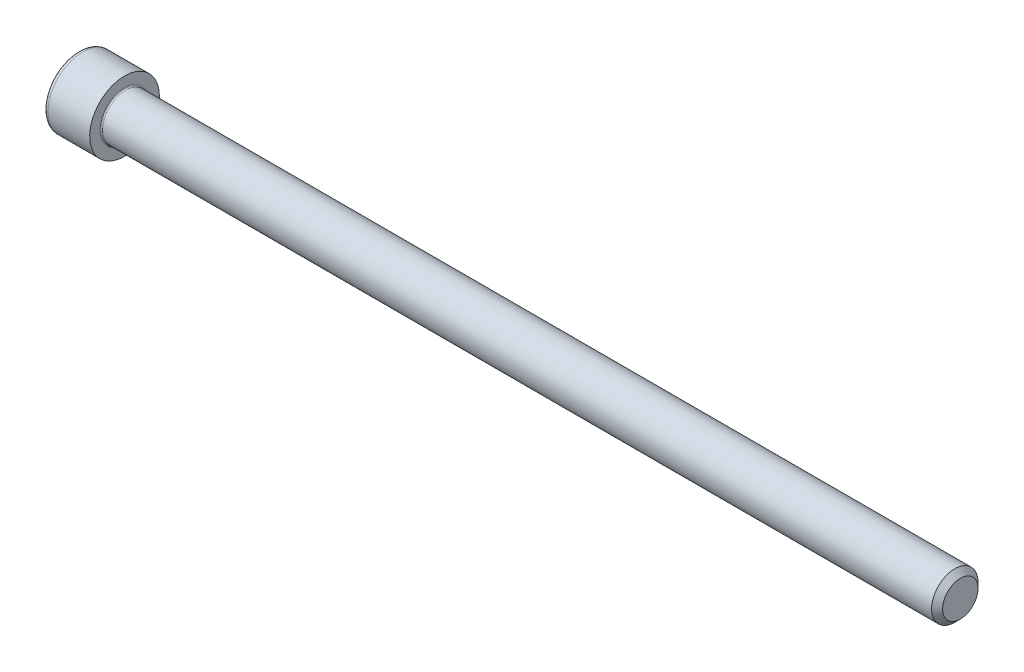
from build123d import *

# Parameters (mm, degrees)
SLOT_REACH    = 122.838
THREAD_R      = 0.635
CHAMFER1_SIZE = 0.75565
FILLET2_R     = 0.1778


with BuildPart() as part:
    # Sketch1 → Body (revolve)
    with BuildSketch(Plane.XY, mode=Mode.PRIVATE) as body_sk:
        Polygon((-1.710266667, 0), (114.3, 0), (114.3, 3.175), (88.9, 3.175), (85.7249, 3.175), (0, 3.175), (0, 4.7625), (-6.35, 4.7625), (-6.35, 2.756963005), (-3.302, 2.756963005), align=None)
    revolve(body_sk.sketch.rotate(Axis((-1.710266667, 0, 0), (1, 0, 0)), 180), axis=Axis((-1.710266667, 0, 0), (1, 0, 0)))

    # Slot: up to this cone (the profile starts inside it)
    slot_end = Plane(origin=(-6.35, 0, 0), z_dir=(-1, 0, 0)).offset(-4.639732333) * Cone(1.732e-06, 235.583136371, 136.0139862, align=(Align.CENTER, Align.CENTER, Align.MIN), mode=Mode.PRIVATE)
    # Sketch2 → Slot (add, up to the surface)
    with BuildSketch(Plane.ZY.offset(6.35), mode=Mode.PRIVATE) as slot_sk1:
        with BuildLine():
            ThreePointArc((1.378481503, -2.3876), (2.3876, -1.378481503), (2.756963005, 0))
            Line((2.756963005, 0), (1.378481503, -2.3876))
        make_face()
    slot_tool1 = extrude(slot_sk1.sketch, amount=-SLOT_REACH, mode=Mode.PRIVATE) & slot_end
    add(slot_tool1.solids().sort_by_distance((-6.35, -1.268114, 2.196438))[0])
    # Sketch2 → Slot (add, up to the surface)
    with BuildSketch(Plane.ZY.offset(6.35), mode=Mode.PRIVATE) as slot_sk2:
        with BuildLine():
            ThreePointArc((-1.378481503, -2.3876), (0, -2.756963005), (1.378481503, -2.3876))
            Line((1.378481503, -2.3876), (-1.378481503, -2.3876))
        make_face()
    slot_tool2 = extrude(slot_sk2.sketch, amount=-SLOT_REACH, mode=Mode.PRIVATE) & slot_end
    add(slot_tool2.solids().sort_by_distance((-6.35, -2.536228, 0))[0])
    # Sketch2 → Slot (add, up to the surface)
    with BuildSketch(Plane.ZY.offset(6.35), mode=Mode.PRIVATE) as slot_sk3:
        with BuildLine():
            ThreePointArc((-2.756963005, 0), (-2.3876, -1.378481503), (-1.378481503, -2.3876))
            Line((-1.378481503, -2.3876), (-2.756963005, 0))
        make_face()
    slot_tool3 = extrude(slot_sk3.sketch, amount=-SLOT_REACH, mode=Mode.PRIVATE) & slot_end
    add(slot_tool3.solids().sort_by_distance((-6.35, -1.268114, -2.196438))[0])
    # Sketch2 → Slot (add, up to the surface)
    with BuildSketch(Plane.ZY.offset(6.35), mode=Mode.PRIVATE) as slot_sk4:
        with BuildLine():
            Line((-2.756963005, 0), (-1.378481503, 2.3876))
            ThreePointArc((-1.378481503, 2.3876), (-2.3876, 1.378481503), (-2.756963005, 0))
        make_face()
    slot_tool4 = extrude(slot_sk4.sketch, amount=-SLOT_REACH, mode=Mode.PRIVATE) & slot_end
    add(slot_tool4.solids().sort_by_distance((-6.35, 1.268114, -2.196438))[0])
    # Sketch2 → Slot (add, up to the surface)
    with BuildSketch(Plane.ZY.offset(6.35), mode=Mode.PRIVATE) as slot_sk5:
        with BuildLine():
            Line((-1.378481503, 2.3876), (1.378481503, 2.3876))
            ThreePointArc((1.378481503, 2.3876), (0, 2.756963005), (-1.378481503, 2.3876))
        make_face()
    slot_tool5 = extrude(slot_sk5.sketch, amount=-SLOT_REACH, mode=Mode.PRIVATE) & slot_end
    add(slot_tool5.solids().sort_by_distance((-6.35, 2.536228, 0))[0])
    # Sketch2 → Slot (add, up to the surface)
    with BuildSketch(Plane.ZY.offset(6.35), mode=Mode.PRIVATE) as slot_sk6:
        with BuildLine():
            Line((1.378481503, 2.3876), (2.756963005, 0))
            ThreePointArc((2.756963005, 0), (2.3876, 1.378481503), (1.378481503, 2.3876))
        make_face()
    slot_tool6 = extrude(slot_sk6.sketch, amount=-SLOT_REACH, mode=Mode.PRIVATE) & slot_end
    add(slot_tool6.solids().sort_by_distance((-6.35, 1.268114, 2.196438))[0])

    # Thread
    thread_edges = [part.edges().sort_by_distance(p)[0] for p in [
        (-6.35, 4.7625, 0),
    ]]
    fillet(thread_edges, radius=THREAD_R)

    # Chamfer1
    chamfer1_edges = [part.edges().sort_by_distance(p)[0] for p in [
        (114.3, 3.175, 0),
    ]]
    chamfer(chamfer1_edges, length=CHAMFER1_SIZE)

    # Fillet2
    fillet2_edges = [part.edges().sort_by_distance(p)[0] for p in [
        (0, 3.175, 0),
    ]]
    fillet(fillet2_edges, radius=FILLET2_R)


solid = part.part
